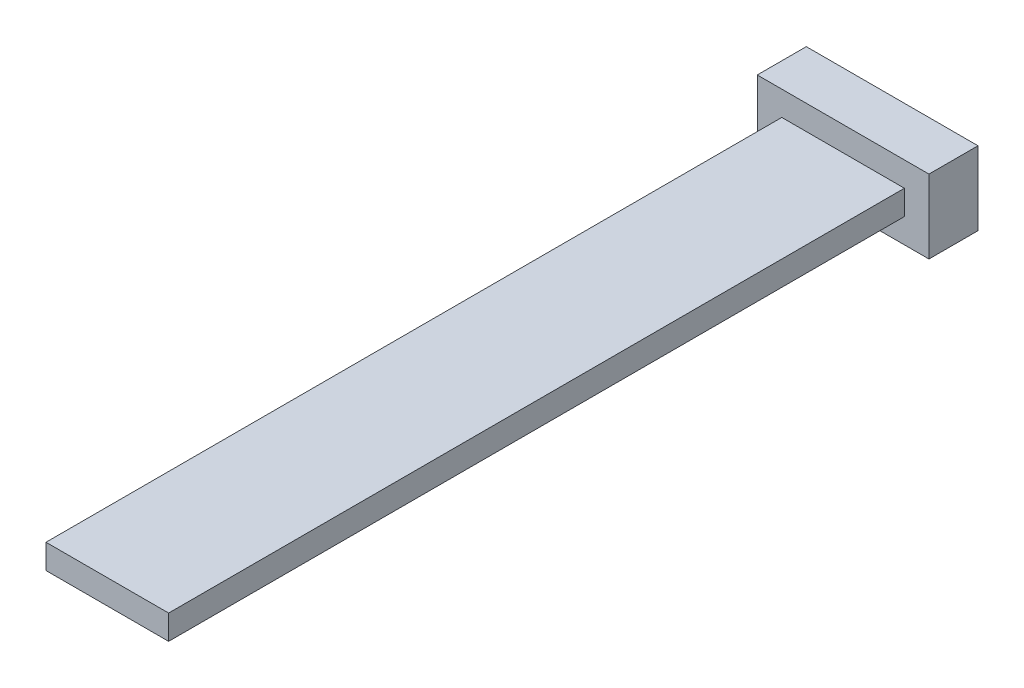
from build123d import *

# Parameters (mm, degrees)
SKETCH1_W           = 50
SKETCH1_H           = 10
BOSS_EXTRUDE1_DEPTH = 300
SKETCH2_W           = 70
SKETCH2_H           = 30
BOSS_EXTRUDE2_DEPTH = 20


with BuildPart() as part:
    # Sketch1 → Boss-Extrude1 (new body)
    with BuildSketch(Plane.XY):
        with Locations((25, 5)):
            Rectangle(SKETCH1_W, SKETCH1_H)
    extrude(amount=BOSS_EXTRUDE1_DEPTH)

    # Sketch2 → Boss-Extrude2 (add)
    with BuildSketch(Plane(origin=(0, 0, 0), x_dir=(-1, 0, 0), z_dir=(0, 0, -1))):
        with Locations((-25, 5)):
            Rectangle(SKETCH2_W, SKETCH2_H)
    extrude(amount=BOSS_EXTRUDE2_DEPTH)


solid = part.part
